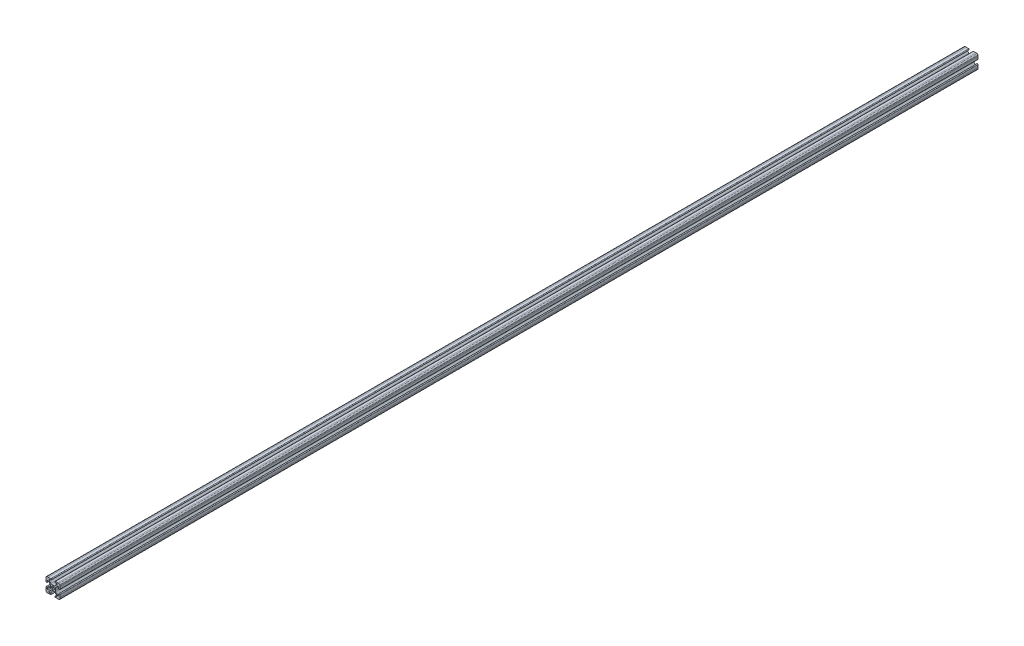
from build123d import *

# Parameters (mm, degrees)
BOSS_EXTRUDE1_DEPTH = 1650.492


with BuildPart() as part:
    # Model → Boss-Extrude1 (new body)
    with BuildSketch(Plane.XY):
        with BuildLine():
            Line((50.659960212, 72.999871414), (53.774553856, 72.999871414))
            ThreePointArc((53.774553856, 72.999871414), (54.989573754, 72.758188929), (56.019617887, 72.069935444))
            Line((56.019617887, 72.069935444), (59.264200891, 68.825352439))
            ThreePointArc((59.264200891, 68.825352439), (59.477513437, 67.701802895), (58.510322513, 67.091550869))
            Line((58.510322513, 67.091550869), (56.572487817, 67.159221548))
            ThreePointArc((56.572487817, 67.159221548), (55.4691069, 66.130302197), (56.498026251, 65.026921279))
            Line((56.498026251, 65.026921279), (60.677257034, 64.880979325))
            Line((60.677257034, 64.880979325), (62.710657034, 64.880979325))
            ThreePointArc((62.710657034, 64.880979325), (64.129537501, 65.468698857), (64.717257034, 66.887579325))
            Line((64.717257034, 66.887579325), (64.717257034, 68.920979325))
            Line((64.717257034, 68.920979325), (64.57131508, 73.100210108))
            ThreePointArc((64.57131508, 73.100210108), (63.467934162, 74.129129459), (62.439014811, 73.025748542))
            Line((62.439014811, 73.025748542), (62.50668549, 71.087913846))
            ThreePointArc((62.50668549, 71.087913846), (61.896433464, 70.120722922), (60.77288392, 70.334035468))
            Line((60.77288392, 70.334035468), (57.528300915, 73.578618472))
            ThreePointArc((57.528300915, 73.578618472), (56.84004743, 74.608662605), (56.598364945, 75.823682503))
            Line((56.598364945, 75.823682503), (56.598364945, 78.938276147))
            ThreePointArc((56.598364945, 78.938276147), (56.84004743, 80.153296044), (57.528300915, 81.183340177))
            Line((57.528300915, 81.183340177), (60.77288392, 84.427923182))
            ThreePointArc((60.77288392, 84.427923182), (61.896433464, 84.641235728), (62.50668549, 83.674044803))
            Line((62.50668549, 83.674044803), (62.439014811, 81.736210108))
            ThreePointArc((62.439014811, 81.736210108), (63.467934162, 80.63282919), (64.57131508, 81.661748542))
            Line((64.57131508, 81.661748542), (64.717257034, 85.840979325))
            Line((64.717257034, 85.840979325), (64.717257034, 87.874379325))
            ThreePointArc((64.717257034, 87.874379325), (64.129537501, 89.293259792), (62.710657034, 89.880979325))
            Line((62.710657034, 89.880979325), (60.677257034, 89.880979325))
            Line((60.677257034, 89.880979325), (56.498026251, 89.73503737))
            ThreePointArc((56.498026251, 89.73503737), (55.4691069, 88.631656452), (56.572487817, 87.602737101))
            Line((56.572487817, 87.602737101), (58.510322513, 87.67040778))
            ThreePointArc((58.510322513, 87.67040778), (59.477513437, 87.060155754), (59.264200891, 85.93660621))
            Line((59.264200891, 85.93660621), (56.019617887, 82.692023205))
            ThreePointArc((56.019617887, 82.692023205), (54.989573754, 82.00376972), (53.774553856, 81.762087236))
            Line((53.774553856, 81.762087236), (50.659960212, 81.762087236))
            ThreePointArc((50.659960212, 81.762087236), (49.444940315, 82.00376972), (48.414896182, 82.692023205))
            Line((48.414896182, 82.692023205), (45.170313177, 85.93660621))
            ThreePointArc((45.170313177, 85.93660621), (44.957000631, 87.060155754), (45.924191556, 87.67040778))
            Line((45.924191556, 87.67040778), (47.862026251, 87.602737101))
            ThreePointArc((47.862026251, 87.602737101), (48.965407169, 88.631656452), (47.936487817, 89.73503737))
            Line((47.936487817, 89.73503737), (43.757257034, 89.880979325))
            Line((43.757257034, 89.880979325), (41.723857034, 89.880979325))
            ThreePointArc((41.723857034, 89.880979325), (40.304976567, 89.293259792), (39.717257034, 87.874379325))
            Line((39.717257034, 87.874379325), (39.717257034, 85.840979325))
            Line((39.717257034, 85.840979325), (39.863198989, 81.661748542))
            ThreePointArc((39.863198989, 81.661748542), (40.966579907, 80.63282919), (41.995499258, 81.736210108))
            Line((41.995499258, 81.736210108), (41.927828579, 83.674044803))
            ThreePointArc((41.927828579, 83.674044803), (42.538080605, 84.641235728), (43.661630149, 84.427923182))
            Line((43.661630149, 84.427923182), (46.906213154, 81.183340177))
            ThreePointArc((46.906213154, 81.183340177), (47.594466639, 80.153296044), (47.836149123, 78.938276147))
            Line((47.836149123, 78.938276147), (47.836149123, 75.823682503))
            ThreePointArc((47.836149123, 75.823682503), (47.594466639, 74.608662605), (46.906213154, 73.578618472))
            Line((46.906213154, 73.578618472), (43.661630149, 70.334035468))
            ThreePointArc((43.661630149, 70.334035468), (42.538080605, 70.120722922), (41.927828579, 71.087913846))
            Line((41.927828579, 71.087913846), (41.995499258, 73.025748542))
            ThreePointArc((41.995499258, 73.025748542), (40.966579907, 74.129129459), (39.863198989, 73.100210108))
            Line((39.863198989, 73.100210108), (39.717257034, 68.920979325))
            Line((39.717257034, 68.920979325), (39.717257034, 66.887579325))
            ThreePointArc((39.717257034, 66.887579325), (40.304976567, 65.468698857), (41.723857034, 64.880979325))
            Line((41.723857034, 64.880979325), (43.757257034, 64.880979325))
            Line((43.757257034, 64.880979325), (47.936487817, 65.026921279))
            ThreePointArc((47.936487817, 65.026921279), (48.965407169, 66.130302197), (47.862026251, 67.159221548))
            Line((47.862026251, 67.159221548), (45.924191556, 67.091550869))
            ThreePointArc((45.924191556, 67.091550869), (44.957000631, 67.701802895), (45.170313177, 68.825352439))
            Line((45.170313177, 68.825352439), (48.414896182, 72.069935444))
            ThreePointArc((48.414896182, 72.069935444), (49.444940315, 72.758188929), (50.659960212, 72.999871414))
        make_face()
        with BuildLine():
            Line((50.64953831, 75.433607249), (50.269884959, 75.433607249))
            Line((50.269884959, 75.433607249), (50.269884959, 75.8132606))
            ThreePointArc((50.269884959, 75.8132606), (53.985023987, 79.148746278), (50.64953831, 75.433607249))
        make_face(mode=Mode.SUBTRACT)
    extrude(amount=BOSS_EXTRUDE1_DEPTH)


solid = part.part
